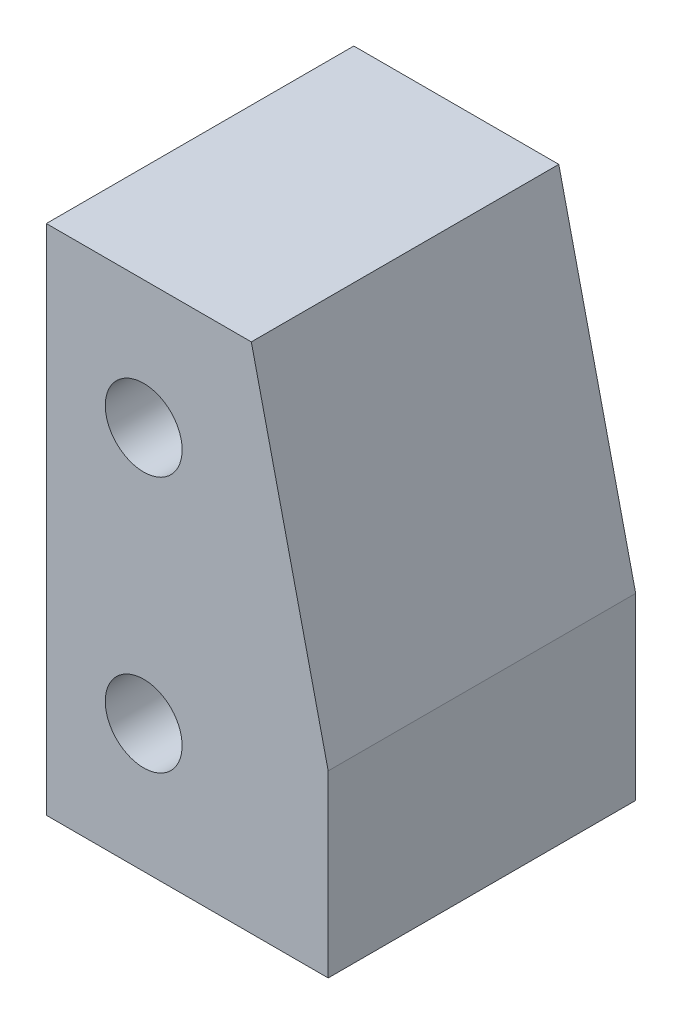
from build123d import *

# Parameters (mm, degrees)
SKETCH_1_W               = 8
SKETCH_1_H               = 20
SKETCH_1_R               = 1.5
EXTRUDE_1_DEPTH          = 12
EXTRUDE_2_DEPTH          = 12
CUT_EXTRUDE_1_DEPTH      = 26.787593916
CUT_EXTRUDE_1_DEPTH_BACK = 7
SKETCH_3_R               = 1.25


with BuildPart() as part:
    # 草图1 → 凸台-拉伸1 (new body)
    with BuildSketch(Plane.XY):
        with Locations((4, 10)):
            Rectangle(SKETCH_1_W, SKETCH_1_H)
        with Locations((3.8, 15)):
            Circle(SKETCH_1_R, mode=Mode.SUBTRACT)
        with Locations(Location((3.8, 5, 0), (0, 0, 180))):
            Circle(SKETCH_1_R, mode=Mode.SUBTRACT)
    extrude(amount=EXTRUDE_1_DEPTH)

    # 草图2 → 凸台-拉伸2 (add)
    with BuildSketch(Plane.XY.offset(12)):
        Polygon((8, 20), (11, 7), (11, 0), (8, 0), align=None)
    extrude(amount=-EXTRUDE_2_DEPTH)

    # 草图3 → 切除-拉伸1 (cut, two sides: drawn at the far end of the back side and taken through both)
    with BuildSketch(Plane.XZ.offset(-CUT_EXTRUDE_1_DEPTH_BACK)):
        with Locations(Location((8, 6, 0), (0, 0, 90))):
            Circle(SKETCH_3_R)
    extrude(amount=CUT_EXTRUDE_1_DEPTH + CUT_EXTRUDE_1_DEPTH_BACK, mode=Mode.SUBTRACT)


solid = part.part
